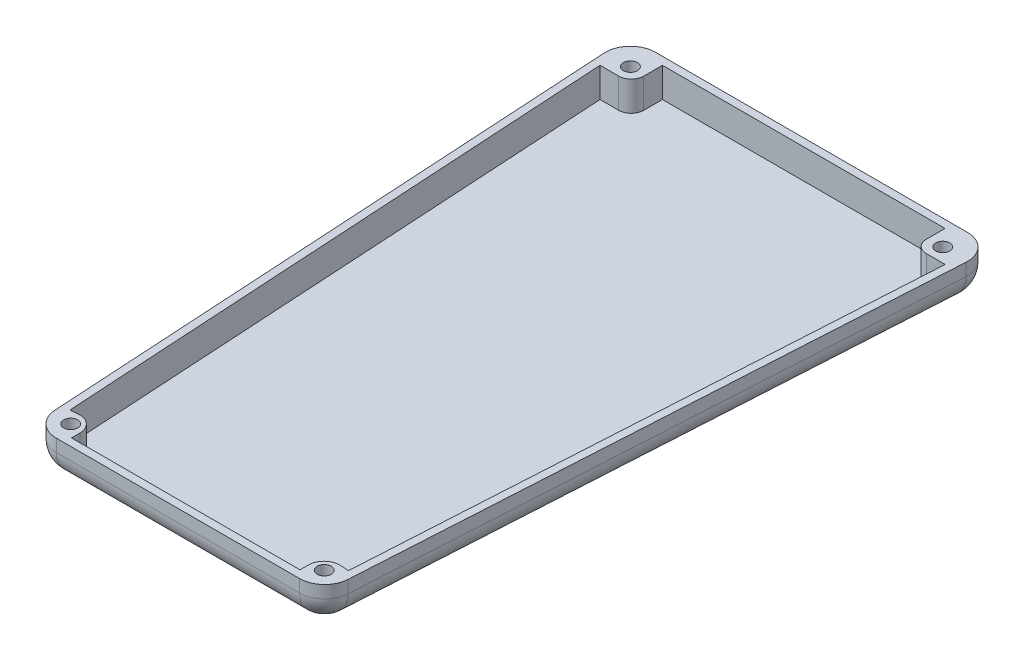
from build123d import *

# Parameters (mm, degrees)
BOSS_EXTRUDE1_DEPTH                                 = 12
SHELL1_T                                            = -2.5
FILLET2_R                                           = 8
SKETCH5_R                                           = 1.5
BOSS_EXTRUDE3_DEPTH                                 = 9.5
FILLET5_R                                           = 4
CSK_FOR_M4_COUNTERSUNK_FLAT_HEAD_SCREW1_D           = 4.5
CSK_FOR_M4_COUNTERSUNK_FLAT_HEAD_SCREW1_CSINK_D     = 9.4
CSK_FOR_M4_COUNTERSUNK_FLAT_HEAD_SCREW1_CSINK_ANGLE = 90
CSK_FOR_M4_COUNTERSUNK_FLAT_HEAD_SCREW2_D           = 4.5
CSK_FOR_M4_COUNTERSUNK_FLAT_HEAD_SCREW2_CSINK_D     = 9.4
CSK_FOR_M4_COUNTERSUNK_FLAT_HEAD_SCREW2_CSINK_ANGLE = 90


with BuildPart() as part:
    # Sketch1 → Boss-Extrude1 (new body)
    with BuildSketch(Plane.XZ.offset(-76.724152422)):
        with BuildLine():
            Line((110.259063934, 82.346126643), (10.232808146, 82.346126643))
            ThreePointArc((10.232808146, 82.346126643), (4.41063977, 84.859565296), (2.246887156, 90.820537791))
            Line((2.246887156, 90.820537791), (13.35579753, 277.820529099))
            ThreePointArc((13.35579753, 277.820529099), (15.855157174, 283.168286326), (21.341718521, 285.346117951))
            Line((21.341718521, 285.346117951), (99.259600005, 285.346117951))
            ThreePointArc((99.259600005, 285.346117951), (104.747858971, 283.166686096), (107.245796332, 277.815871333))
            Line((107.245796332, 277.815871333), (118.24526026, 90.815880025))
            ThreePointArc((118.24526026, 90.815880025), (116.079632079, 84.857867678), (110.259063934, 82.346126643))
        make_face()
    extrude(amount=BOSS_EXTRUDE1_DEPTH)

    # Shell1
    shell1_openings = [part.faces().sort_by_distance(p)[0] for p in [
        (60.272055657, 76.724152422, 180.004596884),
    ]]
    offset(amount=SHELL1_T, openings=shell1_openings, kind=Kind.INTERSECTION)

    # Fillet2
    fillet2_edges = [part.edges().sort_by_distance(p)[0] for p in [
        (104.747858971, 64.724152422, 283.166686096),
        (60.300659263, 64.724152422, 285.346117951),
        (15.855157174, 64.724152422, 283.168286326),
        (7.801342343, 64.724152422, 184.320533445),
        (4.41063977, 64.724152422, 84.859565296),
        (60.24593604, 64.724152422, 82.346126643),
        (116.079632079, 64.724152422, 84.857867678),
        (112.745528296, 64.724152422, 184.315875679),
    ]]
    fillet(fillet2_edges, radius=FILLET2_R)

    # Sketch5 → Boss-Extrude3 (add)
    # profile 1 of 4: a face of its own
    with BuildSketch(Plane(origin=(0, 76.724152422, 0), x_dir=(1, 0, 0), z_dir=(0, 1, 0))):
        with BuildLine():
            Line((104.888526891, -275.315871333), (102.195926429, -275.157490782))
            ThreePointArc((102.195926429, -275.157490782), (98.472168712, -276.511008395), (96.902330565, -280.148863486))
            Line((96.902330565, -280.148863486), (96.902330565, -282.846117951))
            Line((96.902330565, -282.846117951), (99.259600005, -282.846117951))
            ThreePointArc((99.259600005, -282.846117951), (103.032778044, -281.34775855), (104.75010998, -277.669073401))
            Line((104.75010998, -277.669073401), (104.888526891, -275.315871333))
        make_face()
        with Locations(Location((100.902330565, -279.088314379, 0), (0, 0, 270))):
            Circle(SKETCH5_R, mode=Mode.SUBTRACT)
    # profile 2 of 4: a face of its own
    with BuildSketch(Plane(origin=(0, 76.724152422, 0), x_dir=(1, 0, 0), z_dir=(0, 1, 0))):
        with BuildLine():
            Line((18.401104149, -275.160761929), (15.711690126, -275.320529099))
            Line((15.711690126, -275.320529099), (15.85139784, -277.672275615))
            ThreePointArc((15.85139784, -277.672275615), (17.569707595, -281.348858709), (21.341718521, -282.846117951))
            Line((21.341718521, -282.846117951), (23.697611116, -282.846117951))
            Line((23.697611116, -282.846117951), (23.697611116, -280.151962548))
            ThreePointArc((23.697611116, -280.151962548), (22.126711958, -276.513107313), (18.401104149, -275.160761929))
        make_face()
        with Locations(Location((19.697611116, -279.090793629, 0), (0, 0, 270))):
            Circle(SKETCH5_R, mode=Mode.SUBTRACT)
    # profile 3 of 4: a face of its own
    with BuildSketch(Plane(origin=(0, 76.724152422, 0), x_dir=(1, 0, 0), z_dir=(0, 1, 0))):
        with BuildLine():
            Line((14.990438495, -84.846126643), (10.232808146, -84.846126643))
            ThreePointArc((10.232808146, -84.846126643), (6.230067388, -86.574115717), (4.742487465, -90.672284307))
            Line((4.742487465, -90.672284307), (4.990438495, -94.846126643))
            Line((4.990438495, -94.846126643), (14.990438495, -94.846126643))
            Line((14.990438495, -94.846126643), (14.990438495, -84.846126643))
        make_face()
        with Locations(Location((10.232808146, -90.346126643, 0), (0, 0, 270))):
            Circle(SKETCH5_R, mode=Mode.SUBTRACT)
    # profile 4 of 4: a face of its own
    with BuildSketch(Plane(origin=(0, 76.724152422, 0), x_dir=(1, 0, 0), z_dir=(0, 1, 0))):
        with BuildLine():
            Line((105.501426671, -84.821111223), (105.506954269, -94.821109695))
            Line((105.506954269, -94.821109695), (115.506952742, -94.815582097))
            Line((115.506952742, -94.815582097), (115.752596601, -90.641603341))
            ThreePointArc((115.752596601, -90.641603341), (114.262751603, -86.544257652), (110.259056293, -84.818481396))
            Line((110.259056293, -84.818481396), (105.501426671, -84.821111223))
        make_face()
        with Locations(Location((110.259063934, -90.346126643, 0), (0, 0, 270))):
            Circle(SKETCH5_R, mode=Mode.SUBTRACT)
    extrude(amount=-BOSS_EXTRUDE3_DEPTH)

    # Fillet5
    fillet5_edges = [part.edges().sort_by_distance(p)[0] for p in [
        (14.990438495, 71.974152422, 94.846126643),
        (105.506954269, 71.974152422, 94.821109695),
    ]]
    fillet(fillet5_edges, radius=FILLET5_R)

    # CSK for M4 Countersunk Flat Head Screw1 (through all)
    with Locations(Plane(origin=(0, 64.724152422, 0), x_dir=(-1, 0, 0), z_dir=(0, -1, 0))):
        with Locations((-10.232808146, -90.346126643), (-110.259063934, -90.346126643)):
            CounterSinkHole(CSK_FOR_M4_COUNTERSUNK_FLAT_HEAD_SCREW1_D / 2, CSK_FOR_M4_COUNTERSUNK_FLAT_HEAD_SCREW1_CSINK_D / 2, counter_sink_angle=CSK_FOR_M4_COUNTERSUNK_FLAT_HEAD_SCREW1_CSINK_ANGLE)

    # CSK for M4 Countersunk Flat Head Screw2 (through all)
    with Locations(Plane(origin=(0, 64.724152422, 0), x_dir=(-1, 0, 0), z_dir=(0, -1, 0))):
        with Locations((-100.902330565, -279.088314379), (-19.697611116, -279.090793629)):
            CounterSinkHole(CSK_FOR_M4_COUNTERSUNK_FLAT_HEAD_SCREW2_D / 2, CSK_FOR_M4_COUNTERSUNK_FLAT_HEAD_SCREW2_CSINK_D / 2, counter_sink_angle=CSK_FOR_M4_COUNTERSUNK_FLAT_HEAD_SCREW2_CSINK_ANGLE)


solid = part.part
